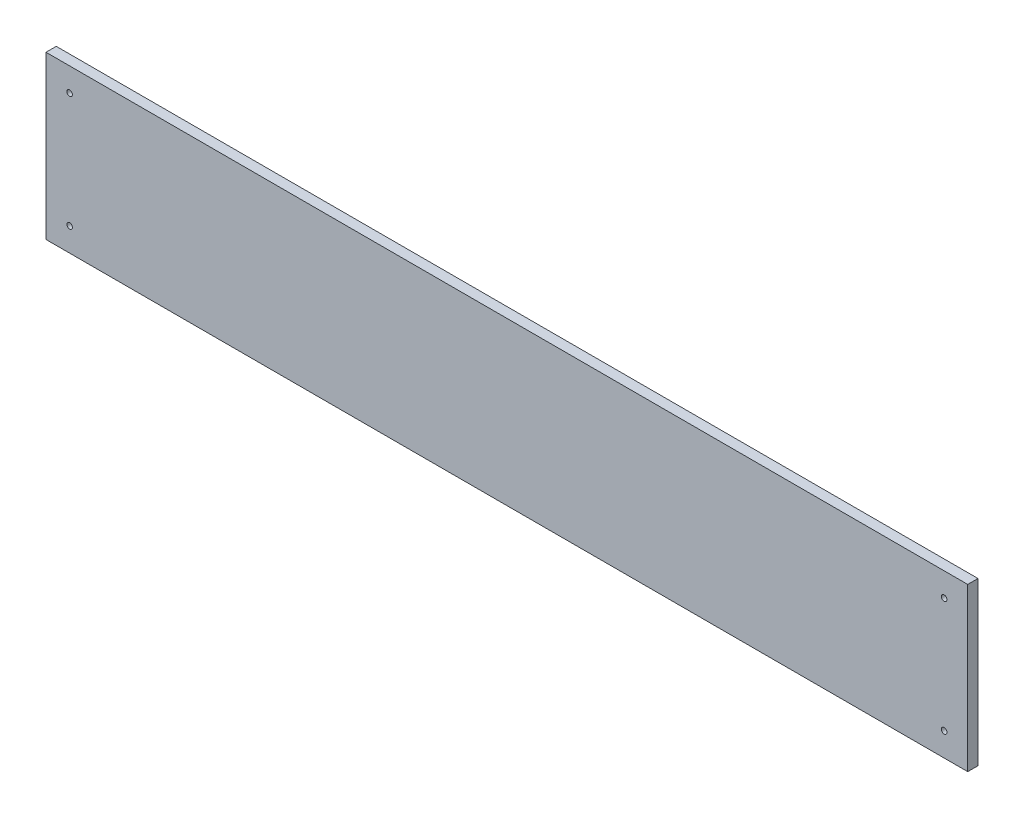
from build123d import *

# Parameters (mm, degrees)
SKETCH_F_W                   = 449
SKETCH_F_H                   = 79
SKETCH_F_R                   = 1.361667817
ESTRUSIONE_ESTRUSIONE1_DEPTH = 5


with BuildPart() as part:
    # Sketch f → Estrusione-Estrusione1 (new body)
    with BuildSketch(Plane.XY):
        with Locations((224.5, 39.5)):
            Rectangle(SKETCH_F_W, SKETCH_F_H)
        with Locations((11.5, 67.5)):
            Circle(SKETCH_F_R, mode=Mode.SUBTRACT)
        with Locations(Location((437.5, 67.5, 0), (0, 0, 180))):
            Circle(SKETCH_F_R, mode=Mode.SUBTRACT)
        with Locations(Location((11.5, 11.5, 0), (0, 0, 180))):
            Circle(SKETCH_F_R, mode=Mode.SUBTRACT)
        with Locations((437.5, 11.5)):
            Circle(SKETCH_F_R, mode=Mode.SUBTRACT)
    extrude(amount=ESTRUSIONE_ESTRUSIONE1_DEPTH)


solid = part.part
